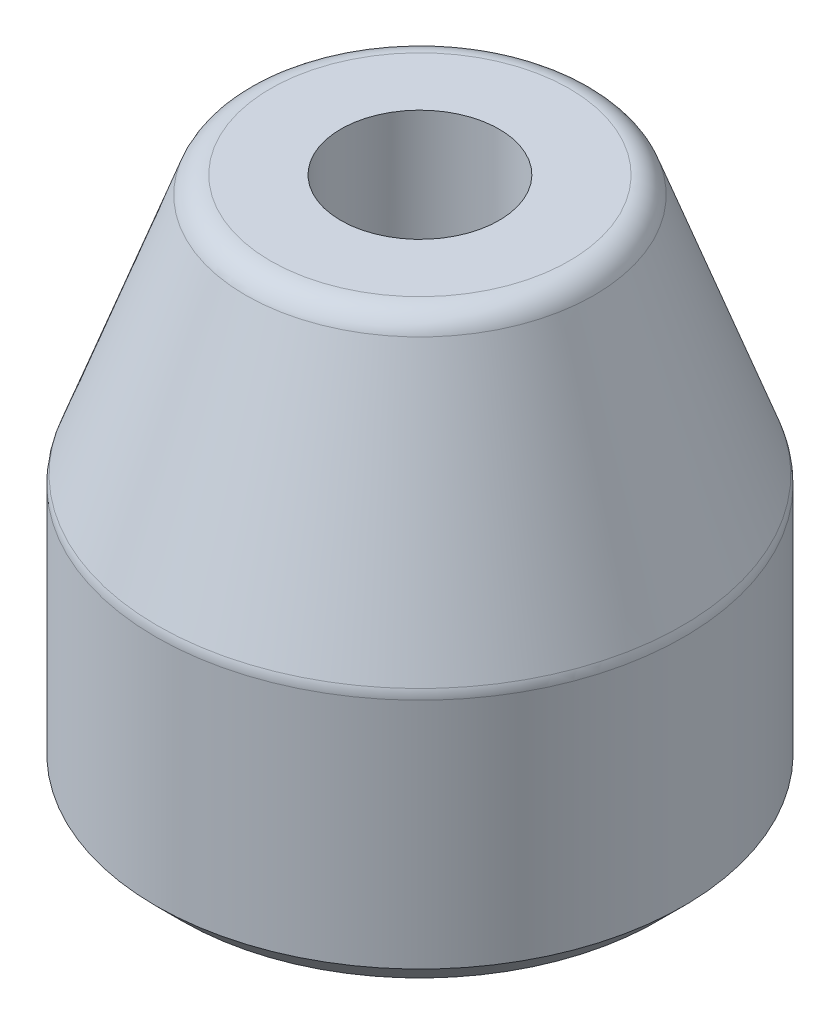
from build123d import *
from OCP.BRepFilletAPI import BRepFilletAPI_MakeChamfer

# Parameters (mm, degrees)
SKETCH1_R           = 5
BOSS_EXTRUDE1_DEPTH = 10
SKETCH2_R           = 1.5
CUT_EXTRUDE1_DEPTH  = 13.247448714
CHAMFER1_SIZE       = 5
CHAMFER1_SIZE2      = 1.819851171
SKETCH3_R           = 3.25
CUT_EXTRUDE2_DEPTH  = 6.940927836
CUT_EXTRUDE2_DRAFT  = -0.5
CHAMFER2_SIZE       = 0.5
CHAMFER2_SIZE2      = 0.504421055
FILLET1_R           = 0.5


with BuildPart() as part:
    # Sketch1 → Boss-Extrude1 (new body)
    with BuildSketch(Plane(origin=(0, 0, 0), x_dir=(1, 0, 0), z_dir=(0, 1, 0))):
        with Locations(Location((0, 0, 0), (0, 0, 270))):
            Circle(SKETCH1_R)
    extrude(amount=BOSS_EXTRUDE1_DEPTH)

    # Sketch2 → Cut-Extrude1 (cut, through all)
    with BuildSketch(Plane(origin=(0, 10, 0), x_dir=(1, 0, 0), z_dir=(0, 1, 0))):
        with Locations(Location((0, 0, 0), (0, 0, 270))):
            Circle(SKETCH2_R)
    extrude(amount=-CUT_EXTRUDE1_DEPTH, mode=Mode.SUBTRACT)

    # Chamfer1
    chamfer1_edges = [part.edges().sort_by_distance(p)[0] for p in [
        (0, 10, -5),
    ]]
    chamfer1_side = [part.faces().sort_by_distance(p)[0] for p in [
        (0, 5, -5),
    ]]
    chamfer(chamfer1_edges, length=CHAMFER1_SIZE, length2=CHAMFER1_SIZE2, reference=chamfer1_side[0])


with BuildPart() as cut_extrude2_tool:
    # Sketch3 → Cut-Extrude2 (with draft: the straight prism first)
    with BuildSketch(Plane.XZ):
        Circle(SKETCH3_R)
    extrude(amount=-CUT_EXTRUDE2_DEPTH)
    # Cut-Extrude2: the draft: its side faces are tilted about the plane it starts from
    cut_extrude2_sides = [cut_extrude2_tool.faces().sort_by_distance(p)[0] for p in [
        (-3.25, 3.470463918, 0),
    ]]
    draft(cut_extrude2_sides, Plane.XZ, CUT_EXTRUDE2_DRAFT)


with BuildPart() as part_1:
    add(part.part)

    # Cut-Extrude2: cut by cut_extrude2_tool
    add(cut_extrude2_tool.part, mode=Mode.SUBTRACT)

    # Chamfer2: one chamfer whose edges measure the first distance from different faces: ONE call of the kernel's chamfer builder (chamfer() names one face for all edges)
    chamfer2_edges_1 = [part_1.edges().sort_by_distance(p)[0] for p in [
        (-3.25, 0, 0),
    ]]
    chamfer2_side_1 = [part_1.faces().sort_by_distance(p)[0] for p in [
        (0, 0, -4.858578644),
    ]]
    chamfer2_edges_2 = [part_1.edges().sort_by_distance(p)[0] for p in [
        (0, 0, -5),
    ]]
    chamfer2 = BRepFilletAPI_MakeChamfer(part_1.part.solid().wrapped)
    for e in chamfer2_edges_1:
        chamfer2.Add(CHAMFER2_SIZE, CHAMFER2_SIZE2, e.wrapped, chamfer2_side_1[0].wrapped)  # the first distance lies on this face
    for e in chamfer2_edges_2:
        chamfer2.Add(CHAMFER2_SIZE, e.wrapped)
    add(Compound.cast(chamfer2.Shape()), mode=Mode.REPLACE)

    # Fillet1
    fillet1_edges = [part_1.edges().sort_by_distance(p)[0] for p in [
        (0, 5, -5),
        (0, 10, -3.180148829),
    ]]
    fillet(fillet1_edges, radius=FILLET1_R)


solid = part_1.part
